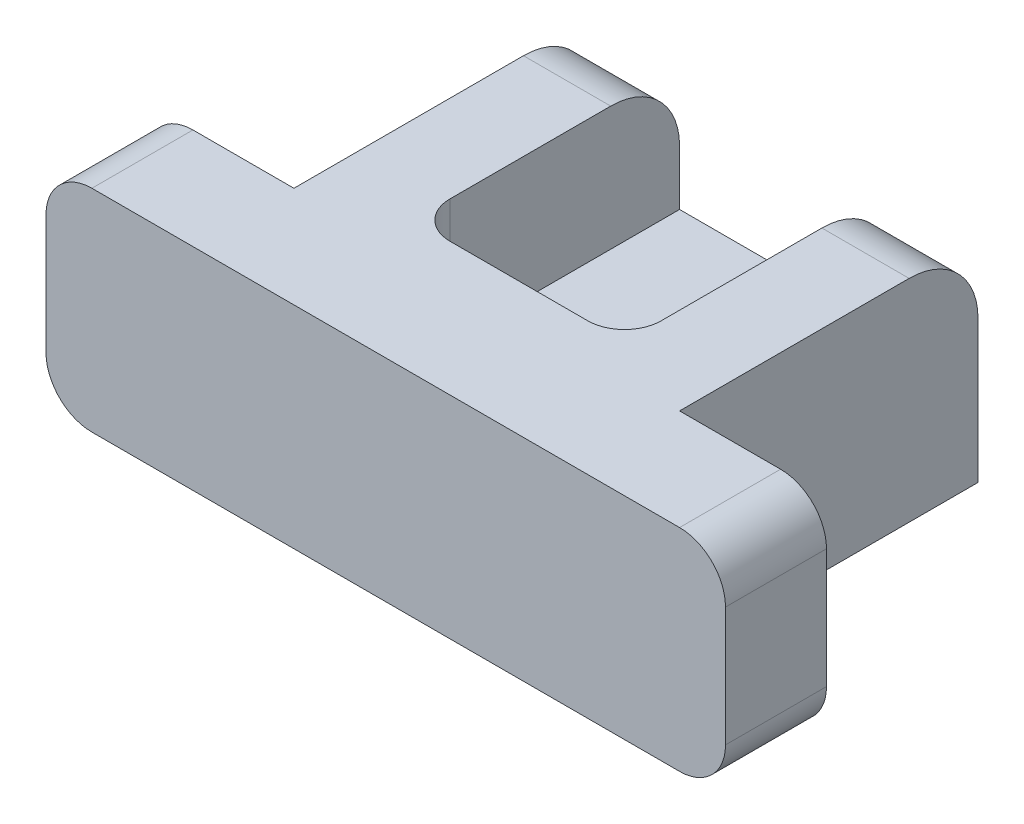
from build123d import *

# Parameters (mm, degrees)
Y_KSEKLIK_EKSTR_ZYON1_DEPTH = 220
IZIM2_W                     = 840
IZIM2_H                     = 650
Y_KSEKLIK_EKSTR_ZYON2_DEPTH = 460
KES_EKSTR_ZYON1_DEPTH       = 270
RADYUS2_R                   = 150
RADYUS3_R                   = 150


with BuildPart() as part:
    # Çizim1 → Yükseklik-Ekstrüzyon1 (new body)
    with BuildSketch(Plane.XY):
        with BuildLine():
            Line((-640, 460), (640, 460))
            ThreePointArc((640, 460), (710.710678119, 430.710678119), (740, 360))
            Line((740, 360), (740, 100))
            ThreePointArc((740, 100), (710.710678119, 29.289321881), (640, 0))
            Line((640, 0), (-640, 0))
            ThreePointArc((-640, 0), (-710.710678119, 29.289321881), (-740, 100))
            Line((-740, 100), (-740, 360))
            ThreePointArc((-740, 360), (-710.710678119, 430.710678119), (-640, 460))
        make_face()
    extrude(amount=Y_KSEKLIK_EKSTR_ZYON1_DEPTH)

    # Çizim2 → Yükseklik-Ekstrüzyon2 (add)
    with BuildSketch(Plane(origin=(0, 460, 0), x_dir=(1, 0, 0), z_dir=(0, 1, 0))):
        with Locations((0, 325)):
            Rectangle(IZIM2_W, IZIM2_H)
    extrude(amount=-Y_KSEKLIK_EKSTR_ZYON2_DEPTH)

    # Çizim3 → Kes-Ekstrüzyon1 (cut)
    with BuildSketch(Plane(origin=(0, 460, 0), x_dir=(1, 0, 0), z_dir=(0, 1, 0))):
        with BuildLine():
            Line((0, 70), (0, 650))
            Line((0, 650), (-230, 650))
            Line((-230, 650), (-230, 150))
            ThreePointArc((-230, 150), (-206.568542495, 93.431457505), (-150, 70))
            Line((-150, 70), (0, 70))
        make_face()
        with BuildLine():
            Line((230, 650), (0, 650))
            Line((0, 650), (0, 70))
            Line((0, 70), (150, 70))
            ThreePointArc((150, 70), (206.568542495, 93.431457505), (230, 150))
            Line((230, 150), (230, 650))
        make_face()
    extrude(amount=-KES_EKSTR_ZYON1_DEPTH, mode=Mode.SUBTRACT)

    # Radyus2
    radyus2_edges = [part.edges().sort_by_distance(p)[0] for p in [
        (-325, 460, -650),
    ]]
    fillet(radyus2_edges, radius=RADYUS2_R)

    # Radyus3
    radyus3_edges = [part.edges().sort_by_distance(p)[0] for p in [
        (325, 460, -650),
    ]]
    fillet(radyus3_edges, radius=RADYUS3_R)


solid = part.part
